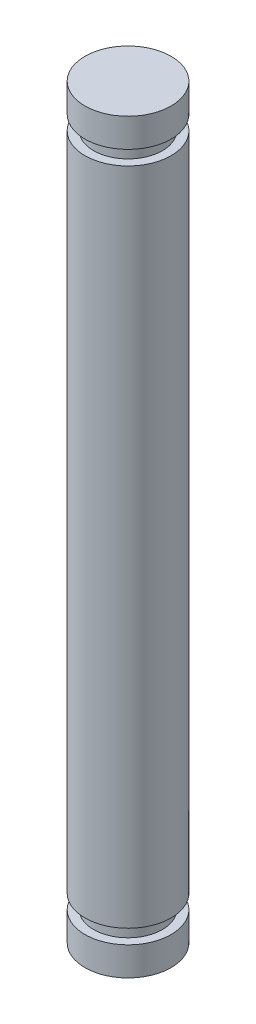
from build123d import *

# Parameters (mm, degrees)
SKETCH1_R           = 1.5
BOSS_EXTRUDE1_DEPTH = 26
SKETCH2_W           = 2.6975544
SKETCH2_H           = 0.5


with BuildPart() as part:
    # Sketch1 → Boss-Extrude1 (new body)
    with BuildSketch(Plane(origin=(0, 0, 0), x_dir=(1, 0, 0), z_dir=(0, 1, 0))):
        with Locations(Location((0, 0, 0), (0, 0, 90))):
            Circle(SKETCH1_R)
    extrude(amount=BOSS_EXTRUDE1_DEPTH)

    # Sketch2 → Cut-Revolve1 (revolve, cut)
    with BuildSketch(Plane(origin=(0, 0, 0), x_dir=(0, 0, -1), z_dir=(1, 0, 0)), mode=Mode.PRIVATE) as cut_revolve1_sk:
        with Locations((-2.5487772, 1.25)):
            Rectangle(SKETCH2_W, SKETCH2_H)
    cut_revolve1 = revolve(cut_revolve1_sk.sketch.rotate(Axis((0, 0, 0), (0, 1, 0)), 180), axis=Axis((0, 0, 0), (0, 1, 0)), mode=Mode.SUBTRACT)

    # Mirror1: Cut-Revolve1 across plane
    add(cut_revolve1.mirror(Plane.ZX.offset(13)), mode=Mode.SUBTRACT)


solid = part.part
